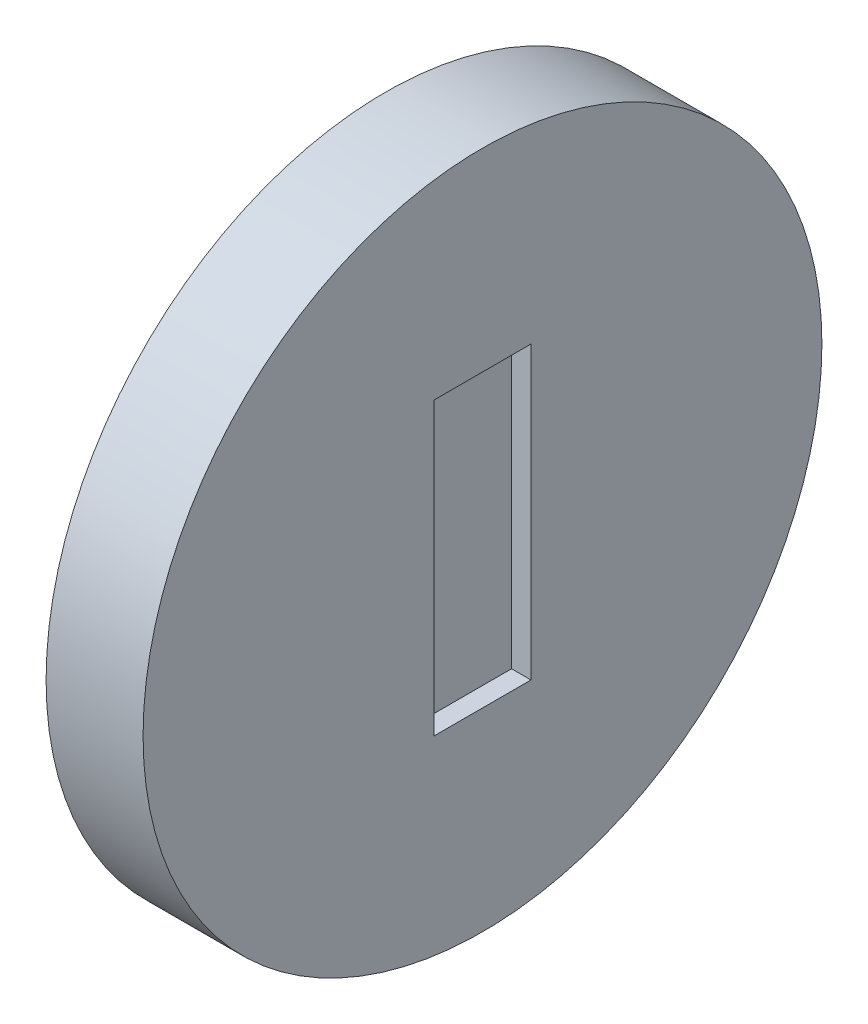
from build123d import *

# Parameters (mm, degrees)
SKETCH1_R           = 17.5
BOSS_EXTRUDE1_DEPTH = 5
SKETCH1_3_W         = 5
SKETCH1_3_H         = 15
CUT_EXTRUDE1_DEPTH  = 1


with BuildPart() as part:
    # Sketch1 → Boss-Extrude1 (new body)
    with BuildSketch(Plane(origin=(0, 0, 0), x_dir=(0, 0, -1), z_dir=(1, 0, 0))):
        Circle(SKETCH1_R)
    extrude(amount=-BOSS_EXTRUDE1_DEPTH)

    # Sketch1<3> → Cut-Extrude1 (cut)
    with BuildSketch(Plane(origin=(0, 0, 0), x_dir=(0, 0, -1), z_dir=(1, 0, 0))):
        Rectangle(SKETCH1_3_W, SKETCH1_3_H)
    extrude(amount=-CUT_EXTRUDE1_DEPTH, mode=Mode.SUBTRACT)


solid = part.part
